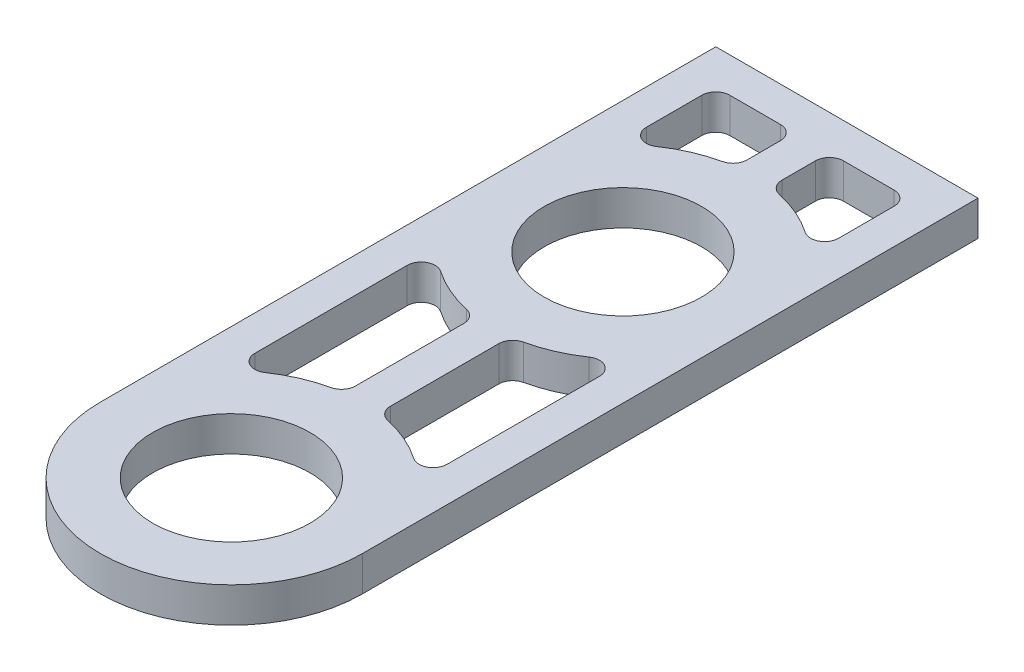
from build123d import *

# Parameters (mm, degrees)
SKETCH1_W           = 47.625
SKETCH1_H           = 152.4
SKETCH1_R           = 14.2875
BOSS_EXTRUDE1_DEPTH = 6.35
CUT_EXTRUDE1_DEPTH  = 81.086188923
FILLET1_R           = 2.54


with BuildPart() as part:
    # Sketch1 → Boss-Extrude1 (new body)
    with BuildSketch(Plane(origin=(0, 0, 0), x_dir=(1, 0, 0), z_dir=(0, 1, 0))):
        Rectangle(SKETCH1_W, SKETCH1_H)
        with Locations(Location((0, 35.5092, 0), (0, 0, 270))):
            Circle(SKETCH1_R, mode=Mode.SUBTRACT)
        with Locations(Location((0, -35.6108, 0), (0, 0, 270))):
            Circle(SKETCH1_R, mode=Mode.SUBTRACT)
    extrude(amount=BOSS_EXTRUDE1_DEPTH)

    # Sketch2 → Cut-Extrude1 (cut, through all)
    with BuildSketch(Plane(origin=(0, 6.35, 0), x_dir=(1, 0, 0), z_dir=(0, 1, 0))):
        with BuildLine():
            ThreePointArc((23.8125, -35.6108), (0, -59.4233), (-23.8125, -35.6108))
            Line((-23.8125, -35.6108), (-23.8125, -76.2))
            Line((-23.8125, -76.2), (23.8125, -76.2))
            Line((23.8125, -76.2), (23.8125, -35.6108))
        make_face()
        with BuildLine():
            Line((-17.4625, 69.85), (-17.4625, 51.698586956))
            ThreePointArc((-17.4625, 51.698586956), (-10.963825458, 56.647546377), (-3.175, 59.109084136))
            Line((-3.175, 59.109084136), (-3.175, 69.85))
            Line((-3.175, 69.85), (-17.4625, 69.85))
        make_face()
        with BuildLine():
            ThreePointArc((-3.175, 11.909315864), (-10.963825458, 14.370853623), (-17.4625, 19.319813044))
            Line((-17.4625, 19.319813044), (-17.4625, -19.421413044))
            ThreePointArc((-17.4625, -19.421413044), (-10.963825458, -14.472453623), (-3.175, -12.010915864))
            Line((-3.175, -12.010915864), (-3.175, 11.909315864))
        make_face()
        with BuildLine():
            ThreePointArc((3.175, 59.109084136), (10.963825458, 56.647546377), (17.4625, 51.698586956))
            Line((17.4625, 51.698586956), (17.4625, 69.85))
            Line((17.4625, 69.85), (3.175, 69.85))
            Line((3.175, 69.85), (3.175, 59.109084136))
        make_face()
        with BuildLine():
            Line((17.4625, -19.421413044), (17.4625, 19.319813044))
            ThreePointArc((17.4625, 19.319813044), (10.963825458, 14.370853623), (3.175, 11.909315864))
            Line((3.175, 11.909315864), (3.175, -12.010915864))
            ThreePointArc((3.175, -12.010915864), (10.963825458, -14.472453623), (17.4625, -19.421413044))
        make_face()
    extrude(amount=-CUT_EXTRUDE1_DEPTH, mode=Mode.SUBTRACT)

    # Fillet1
    fillet1_edges = [part.edges().sort_by_distance(p)[0] for p in [
        (-3.175, 3.175, -59.109084136),
        (-17.4625, 3.175, -51.698586956),
        (-17.4625, 3.175, -69.85),
        (-3.175, 3.175, -69.85),
        (17.4625, 3.175, -51.698586956),
        (3.175, 3.175, -59.109084136),
        (3.175, 3.175, -69.85),
        (17.4625, 3.175, -69.85),
        (-3.175, 3.175, 12.010915864),
        (-17.4625, 3.175, 19.421413044),
        (-17.4625, 3.175, -19.319813044),
        (-3.175, 3.175, -11.909315864),
        (17.4625, 3.175, 19.421413044),
        (3.175, 3.175, 12.010915864),
        (3.175, 3.175, -11.909315864),
        (17.4625, 3.175, -19.319813044),
    ]]
    fillet(fillet1_edges, radius=FILLET1_R)


solid = part.part
